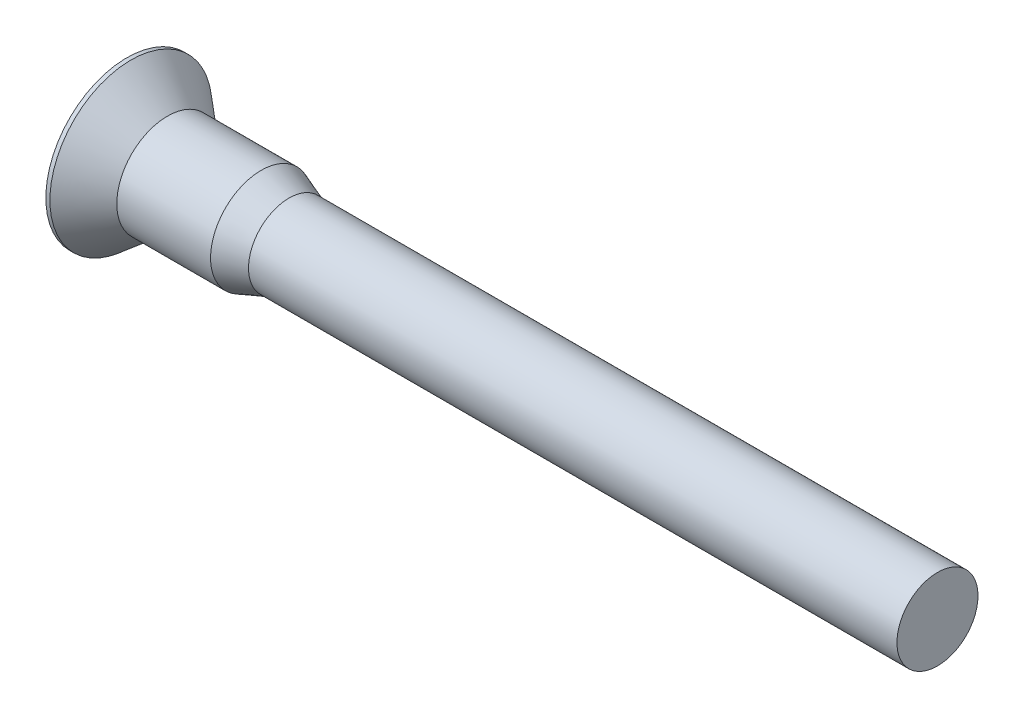
from build123d import *

# Parameters (mm, degrees)
CUT_EXTRUDE1_DEPTH = 2


with BuildPart() as part:
    # Sketch1 → Revolve1 (revolve)
    with BuildSketch(Plane(origin=(0, 0, 0), x_dir=(1, 0, 0), z_dir=(0, 1, 0))):
        Polygon((0, 0), (0, 4), (0.2, 4), (2, 2.5), (6.627677822, 2.5), (8, 2), (40, 2), (40, 0), align=None)
    revolve(axis=Axis((40, 0, 0), (-1, 0, 0)))

    # Sketch2 → Cut-Extrude1 (cut)
    with BuildSketch(Plane.ZY):
        Polygon((1.987284991, 1.176448765), (-0.025192021, 2.30926367), (-2.012477012, 1.132814905), (-1.987284991, -1.176448765), (0.025192021, -2.30926367), (2.012477012, -1.132814905), align=None)
    extrude(amount=-CUT_EXTRUDE1_DEPTH, mode=Mode.SUBTRACT)


solid = part.part
